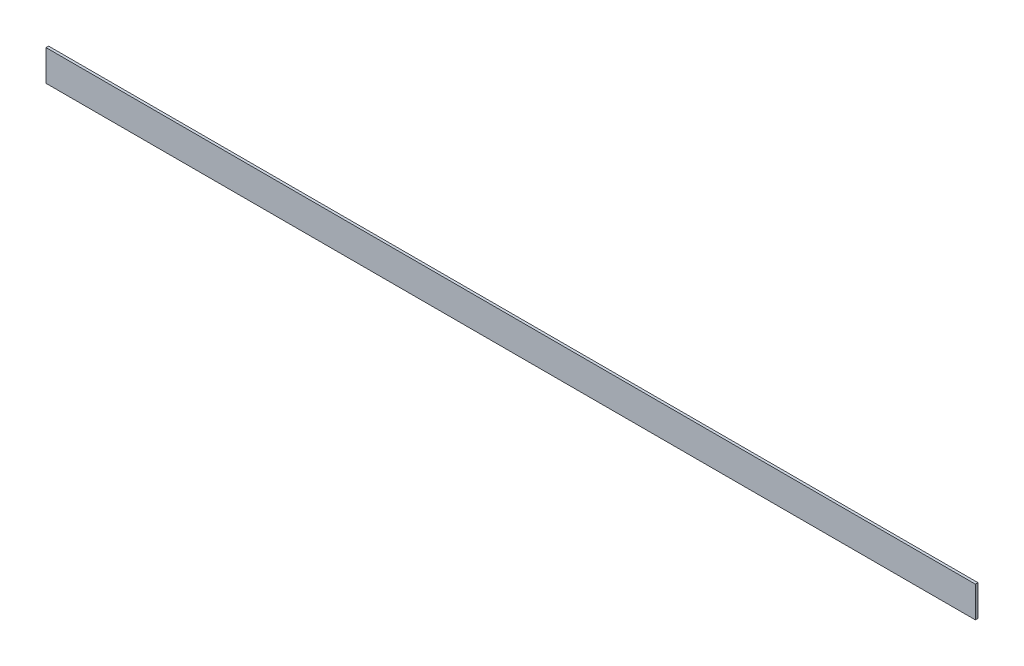
from build123d import *

# Parameters (mm, degrees)
SKETCH1_W           = 360
SKETCH1_H           = 12
BOSS_EXTRUDE1_DEPTH = 1


with BuildPart() as part:
    # Sketch1 → Boss-Extrude1 (new body)
    with BuildSketch(Plane.XY):
        with Locations((180, 6)):
            Rectangle(SKETCH1_W, SKETCH1_H)
    extrude(amount=BOSS_EXTRUDE1_DEPTH)


solid = part.part
